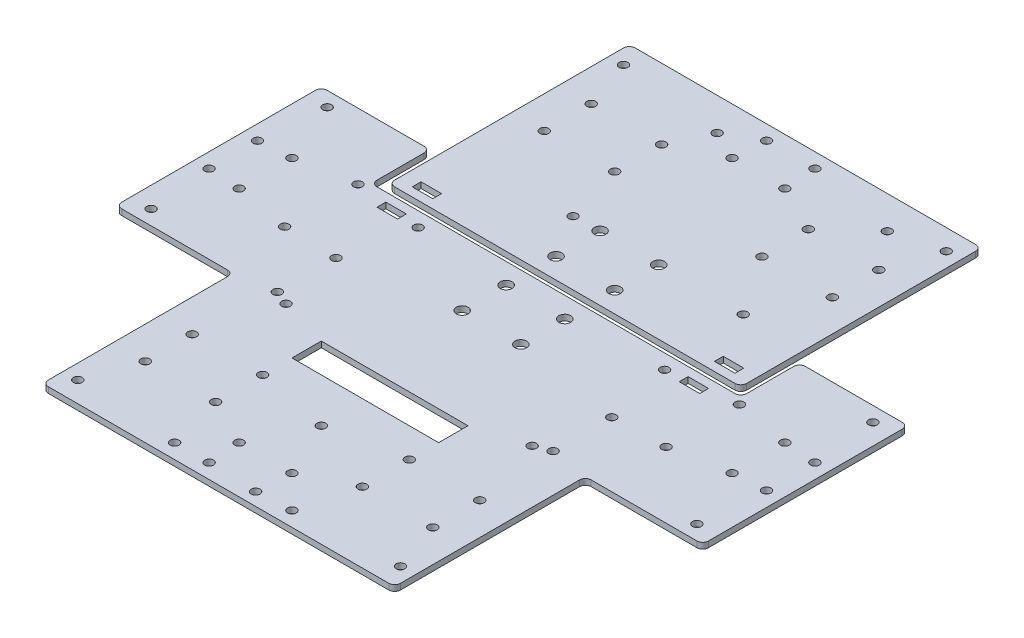
from build123d import *

# Parameters (mm, degrees)
SKETCH_1_W             = 200
SKETCH_1_H             = 200
EXTRUDE_341_DEPTH      = 2
SKETCH_2_W             = 40
SKETCH_2_H             = 65
CUT_EXTRUDE_671_DEPTH  = 2
SKETCH_3_R             = 1.5
CUT_EXTRUDE_1454_DEPTH = 2
SKETCH_4_R             = 1.5
CUT_EXTRUDE_2155_DEPTH = 2
SKETCH_5_R             = 1.5
CUT_EXTRUDE_3116_DEPTH = 10
SKETCH_7_R             = 2
CUT_EXTRUDE_3951_DEPTH = 10
CUT_EXTRUDE_4268_DEPTH = 10
FILLET_4341_R          = 2
FILLET_4941_R          = 2
SKETCH_11_R            = 1.5
CUT_EXTRUDE_1_DEPTH    = 10
SKETCH_13_R            = 1.5
CUT_EXTRUDE_3_DEPTH    = 10
SKETCH_14_R            = 1.5
CUT_EXTRUDE_4_DEPTH    = 10
SKETCH_15_R            = 1.5
CUT_EXTRUDE_5_DEPTH    = 10
SKETCH_16_R            = 1.5
CUT_EXTRUDE_6_DEPTH    = 10
SKETCH_17_W            = 50
SKETCH_17_H            = 10
CUT_EXTRUDE_7_DEPTH    = 10
SKETCH_18_W            = 7
SKETCH_18_H            = 3
CUT_EXTRUDE_8_DEPTH    = 10
SKETCH_19_R            = 1.5
CUT_EXTRUDE_9_DEPTH    = 10


with BuildPart() as part:
    # 草图1 → Extrude 341 (new body)
    with BuildSketch(Plane(origin=(0, 0, 0), x_dir=(1, 0, 0), z_dir=(0, 1, 0))):
        with Locations((2.122728297, 5.919482435)):
            Rectangle(SKETCH_1_W, SKETCH_1_H)
    extrude(amount=EXTRUDE_341_DEPTH)

    # 草图2 → Cut-Extrude 671 (cut)
    with BuildSketch(Plane(origin=(0, 2, 0), x_dir=(1, 0, 0), z_dir=(0, 1, 0))):
        with Locations((-77.877271703, 73.419482435)):
            Rectangle(SKETCH_2_W, SKETCH_2_H)
        with Locations((82.122728297, 73.419482435)):
            Rectangle(SKETCH_2_W, SKETCH_2_H)
        with Locations((82.122728297, -61.580517565)):
            Rectangle(SKETCH_2_W, SKETCH_2_H)
        with Locations((-77.877271703, -61.580517565)):
            Rectangle(SKETCH_2_W, SKETCH_2_H)
    extrude(amount=-CUT_EXTRUDE_671_DEPTH, mode=Mode.SUBTRACT)

    # 草图3 → Cut-Extrude 1454 (cut)
    with BuildSketch(Plane(origin=(0, 2, 0), x_dir=(1, 0, 0), z_dir=(0, 1, 0))):
        with Locations(Location((-46.877271703, 81.919482435, 0), (0, 0, 270))):
            Circle(SKETCH_3_R)
        with Locations(Location((-22.877271703, 81.919482435, 0), (0, 0, 270))):
            Circle(SKETCH_3_R)
        with Locations(Location((-46.877271703, 65.919482435, 0), (0, 0, 270))):
            Circle(SKETCH_3_R)
        with Locations(Location((-22.877271703, 65.919482435, 0), (0, 0, 270))):
            Circle(SKETCH_3_R)
        with Locations(Location((-46.877271703, -54.080517565, 0), (0, 0, 270))):
            Circle(SKETCH_3_R)
        with Locations(Location((-22.877271703, -54.080517565, 0), (0, 0, 270))):
            Circle(SKETCH_3_R)
        with Locations(Location((-46.877271703, -70.080517565, 0), (0, 0, 270))):
            Circle(SKETCH_3_R)
        with Locations(Location((-22.877271703, -70.080517565, 0), (0, 0, 270))):
            Circle(SKETCH_3_R)
        with Locations(Location((27.122728297, -54.080517565, 0), (0, 0, 270))):
            Circle(SKETCH_3_R)
        with Locations(Location((51.122728297, -54.080517565, 0), (0, 0, 270))):
            Circle(SKETCH_3_R)
        with Locations(Location((27.122728297, -70.080517565, 0), (0, 0, 270))):
            Circle(SKETCH_3_R)
        with Locations(Location((51.122728297, -70.080517565, 0), (0, 0, 270))):
            Circle(SKETCH_3_R)
        with Locations(Location((27.122728297, 81.919482435, 0), (0, 0, 270))):
            Circle(SKETCH_3_R)
        with Locations(Location((51.122728297, 81.919482435, 0), (0, 0, 270))):
            Circle(SKETCH_3_R)
        with Locations(Location((27.310966497, 65.920589774, 0), (0, 0, 270))):
            Circle(SKETCH_3_R)
        with Locations(Location((51.310966497, 65.920589774, 0), (0, 0, 270))):
            Circle(SKETCH_3_R)
    extrude(amount=-CUT_EXTRUDE_1454_DEPTH, mode=Mode.SUBTRACT)

    # 草图4 → Cut-Extrude 2155 (cut)
    with BuildSketch(Plane(origin=(0, 2, 0), x_dir=(1, 0, 0), z_dir=(0, 1, 0))):
        with Locations(Location((-6.877271703, 89.919482435, 0), (0, 0, 270))):
            Circle(SKETCH_4_R)
        with Locations(Location((11.122728297, 89.919482435, 0), (0, 0, 270))):
            Circle(SKETCH_4_R)
        with Locations(Location((-6.877271703, -78.080517565, 0), (0, 0, 270))):
            Circle(SKETCH_4_R)
        with Locations(Location((11.122728297, -78.080517565, 0), (0, 0, 270))):
            Circle(SKETCH_4_R)
        with Locations(Location((-81.877271703, 14.919482435, 0), (0, 0, 270))):
            Circle(SKETCH_4_R)
        with Locations(Location((-81.877271703, -3.080517565, 0), (0, 0, 270))):
            Circle(SKETCH_4_R)
        with Locations(Location((86.122728297, 14.919482435, 0), (0, 0, 270))):
            Circle(SKETCH_4_R)
        with Locations(Location((86.122728297, -3.080517565, 0), (0, 0, 270))):
            Circle(SKETCH_4_R)
    extrude(amount=-CUT_EXTRUDE_2155_DEPTH, mode=Mode.SUBTRACT)

    # 草图5 → Cut-Extrude 3116 (cut)
    with BuildSketch(Plane(origin=(0, 2, 0), x_dir=(1, 0, 0), z_dir=(0, 1, 0))):
        with Locations(Location((-52.877271703, -87.080517565, 0), (0, 0, 270))):
            Circle(SKETCH_5_R)
        with Locations(Location((57.122728297, -87.080517565, 0), (0, 0, 270))):
            Circle(SKETCH_5_R)
        with Locations(Location((57.122728297, 98.919482435, 0), (0, 0, 270))):
            Circle(SKETCH_5_R)
        with Locations(Location((-52.877271703, 98.919482435, 0), (0, 0, 270))):
            Circle(SKETCH_5_R)
        with Locations(Location((-90.877271703, 35.919482435, 0), (0, 0, 270))):
            Circle(SKETCH_5_R)
        with Locations(Location((-90.877271703, -24.080517565, 0), (0, 0, 270))):
            Circle(SKETCH_5_R)
        with Locations(Location((95.122728297, 35.919482435, 0), (0, 0, 270))):
            Circle(SKETCH_5_R)
        with Locations(Location((95.122728297, -24.080517565, 0), (0, 0, 270))):
            Circle(SKETCH_5_R)
    extrude(amount=-CUT_EXTRUDE_3116_DEPTH, mode=Mode.SUBTRACT)

    # 草图7 → Cut-Extrude 3951 (cut)
    with BuildSketch(Plane(origin=(0, 2, 0), x_dir=(1, 0, 0), z_dir=(0, 1, 0))):
        with Locations(Location((-7.877271703, 45.919482435, 0), (0, 0, 270))):
            Circle(SKETCH_7_R)
        with Locations(Location((-7.877271703, 30.919482435, 0), (0, 0, 270))):
            Circle(SKETCH_7_R)
        with Locations(Location((-7.877271703, 13.919482435, 0), (0, 0, 270))):
            Circle(SKETCH_7_R)
        with Locations(Location((-7.877271703, -1.080517565, 0), (0, 0, 270))):
            Circle(SKETCH_7_R)
        with Locations(Location((12.122728297, 45.919482435, 0), (0, 0, 270))):
            Circle(SKETCH_7_R)
        with Locations(Location((12.122728297, 30.919482435, 0), (0, 0, 270))):
            Circle(SKETCH_7_R)
        with Locations(Location((12.122728297, 13.919482435, 0), (0, 0, 270))):
            Circle(SKETCH_7_R)
        with Locations(Location((12.122728297, -1.080517565, 0), (0, 0, 270))):
            Circle(SKETCH_7_R)
    extrude(amount=-CUT_EXTRUDE_3951_DEPTH, mode=Mode.SUBTRACT)

    # 草图8 → Cut-Extrude 4268 (cut)
    with BuildSketch(Plane(origin=(0, 2, 0), x_dir=(1, 0, 0), z_dir=(0, 1, 0))):
        Polygon((-57.877271703, 40.919482435), (-57.877271703, 23.919482435), (62.122728297, 23.919482435), (62.122728297, 40.919482435), (65.122728297, 40.919482435), (65.122728297, 20.919482435), (-60.877271703, 20.919482435), (-60.877271703, 40.919482435), align=None)
    extrude(amount=-CUT_EXTRUDE_4268_DEPTH, mode=Mode.SUBTRACT)


with BuildPart() as cut_extrude_4268_piece_1:
    # of the separate pieces the step leaves, piece 1, a body of its own (cut_extrude_4268_pieces)
    add(part.part.solids().sort_by_distance((-60.877271703, 0, -40.919482435))[0])

    # Fillet 4341
    fillet_4341_edges = [cut_extrude_4268_piece_1.edges().sort_by_distance(p)[0] for p in [
        (-60.877271703, 1, -40.919482435),
        (65.122728297, 1, -20.919482435),
        (-60.877271703, 1, -20.919482435),
        (65.122728297, 1, -40.919482435),
        (-97.877271703, 1, 29.080517565),
        (-57.877271703, 1, 29.080517565),
        (-57.877271703, 1, 94.080517565),
        (102.122728297, 1, 29.080517565),
        (62.122728297, 1, 94.080517565),
        (62.122728297, 1, 29.080517565),
        (102.122728297, 1, -40.919482435),
        (-97.877271703, 1, -40.919482435),
    ]]
    fillet(fillet_4341_edges, radius=FILLET_4341_R)

    # 草图11 → 切除-拉伸1 (cut)
    with BuildSketch(Plane(origin=(0, 2, 0), x_dir=(1, 0, 0), z_dir=(0, 1, 0))):
        with Locations(Location((-17.877271703, -89.080517565, 0), (0, 0, 270))):
            Circle(SKETCH_11_R)
        with Locations(Location((22.122728297, -89.080517565, 0), (0, 0, 270))):
            Circle(SKETCH_11_R)
        with Locations(Location((2.122728297, -59.080517565, 0), (0, 0, 270))):
            Circle(SKETCH_11_R)
    extrude(amount=-CUT_EXTRUDE_1_DEPTH, mode=Mode.SUBTRACT)

    # 草图13 → 切除-拉伸3 (cut)
    with BuildSketch(Plane(origin=(0, 2, 0), x_dir=(1, 0, 0), z_dir=(0, 1, 0))):
        with Locations(Location((-39.877271703, 15.919482435, 0), (0, 0, 270))):
            Circle(SKETCH_13_R)
        with Locations(Location((44.122728297, 15.919482435, 0), (0, 0, 270))):
            Circle(SKETCH_13_R)
        with Locations(Location((-39.877271703, -29.080517565, 0), (0, 0, 270))):
            Circle(SKETCH_13_R)
        with Locations(Location((43.982792611, -29.080517565, 0), (0, 0, 270))):
            Circle(SKETCH_13_R)
    extrude(amount=-CUT_EXTRUDE_3_DEPTH, mode=Mode.SUBTRACT)


with BuildPart() as cut_extrude_4268_piece_2:
    # of the separate pieces the step leaves, piece 2, a body of its own (cut_extrude_4268_pieces)
    add(part.part.solids().sort_by_distance((-57.877271703, 0, -105.919482435))[0])

    # Fillet 4941
    fillet_4941_edges = [cut_extrude_4268_piece_2.edges().sort_by_distance(p)[0] for p in [
        (-57.877271703, 1, -105.919482435),
        (62.122728297, 1, -105.919482435),
        (-57.877271703, 1, -23.919482435),
        (62.122728297, 1, -23.919482435),
    ]]
    fillet(fillet_4941_edges, radius=FILLET_4941_R)


with BuildPart() as cut_extrude_4_tool:
    # 草图14 → 切除-拉伸4 (new body)
    with BuildSketch(Plane(origin=(0, 2, 0), x_dir=(1, 0, 0), z_dir=(0, 1, 0))):
        with Locations(Location((-6.127271703, 100.919482435, 0), (0, 0, 270))):
            Circle(SKETCH_14_R)
        with Locations(Location((10.372728297, 100.919482435, 0), (0, 0, 270))):
            Circle(SKETCH_14_R)
        with Locations(Location((-6.114539492, -89.080517565, 0), (0, 0, 270))):
            Circle(SKETCH_14_R)
        with Locations(Location((10.372728297, -89.728592295, 0), (0, 0, 270))):
            Circle(SKETCH_14_R)
        with Locations(Location((-92.877271703, 14.169482435, 0), (0, 0, 270))):
            Circle(SKETCH_14_R)
        with Locations(Location((-92.877271703, -2.330517565, 0), (0, 0, 270))):
            Circle(SKETCH_14_R)
        with Locations(Location((97.122728297, 14.169482435, 0), (0, 0, 270))):
            Circle(SKETCH_14_R)
        with Locations(Location((97.122728297, -2.330517565, 0), (0, 0, 270))):
            Circle(SKETCH_14_R)
    extrude(amount=-CUT_EXTRUDE_4_DEPTH)


with BuildPart() as cut_extrude_4268_piece_1_1:
    add(cut_extrude_4268_piece_1.part)

    # 切除-拉伸4: cut by cut_extrude_4_tool
    add(cut_extrude_4_tool.part, mode=Mode.SUBTRACT)

    # 草图15 → 切除-拉伸5 (cut)
    with BuildSketch(Plane(origin=(0, 2, 0), x_dir=(1, 0, 0), z_dir=(0, 1, 0))):
        with Locations(Location((-44.877271703, -7.080517565, 0), (0, 0, 270))):
            Circle(SKETCH_15_R)
        with Locations(Location((-44.877271703, -27.080517565, 0), (0, 0, 270))):
            Circle(SKETCH_15_R)
        with Locations(Location((49.122728297, -7.080517565, 0), (0, 0, 270))):
            Circle(SKETCH_15_R)
        with Locations(Location((49.122728297, -27.080517565, 0), (0, 0, 270))):
            Circle(SKETCH_15_R)
    extrude(amount=-CUT_EXTRUDE_5_DEPTH, mode=Mode.SUBTRACT)

    # 草图17 → 切除-拉伸7 (cut)
    with BuildSketch(Plane(origin=(0, 2, 0), x_dir=(1, 0, 0), z_dir=(0, 1, 0))):
        with Locations((2.122728297, -39.080517565)):
            Rectangle(SKETCH_17_W, SKETCH_17_H)
    extrude(amount=-CUT_EXTRUDE_7_DEPTH, mode=Mode.SUBTRACT)


with BuildPart() as cut_extrude_4268_piece_2_1:
    add(cut_extrude_4268_piece_2.part)

    # 切除-拉伸4: cut by cut_extrude_4_tool
    add(cut_extrude_4_tool.part, mode=Mode.SUBTRACT)

    # 草图16 → 切除-拉伸6 (cut)
    with BuildSketch(Plane(origin=(0, 2, 0), x_dir=(1, 0, 0), z_dir=(0, 1, 0))):
        with Locations(Location((-16.827271703, 94.765125879, 0), (0, 0, 270))):
            Circle(SKETCH_16_R)
        with Locations(Location((41.172728297, 94.765125879, 0), (0, 0, 270))):
            Circle(SKETCH_16_R)
        with Locations(Location((41.172728297, 45.665125879, 0), (0, 0, 270))):
            Circle(SKETCH_16_R)
        with Locations(Location((-16.827271703, 45.665125879, 0), (0, 0, 270))):
            Circle(SKETCH_16_R)
    extrude(amount=-CUT_EXTRUDE_6_DEPTH, mode=Mode.SUBTRACT)


with BuildPart() as cut_extrude_8_tool:
    # 草图18 → 切除-拉伸8 (new body)
    with BuildSketch(Plane.XZ):
        with Locations((53.622728297, -28.419482435)):
            Rectangle(SKETCH_18_W, SKETCH_18_H)
        with Locations((53.622728297, -16.419482435)):
            Rectangle(SKETCH_18_W, SKETCH_18_H)
        with Locations((-49.377271703, -28.419482435)):
            Rectangle(SKETCH_18_W, SKETCH_18_H)
        with Locations((-49.377271703, -16.419482435)):
            Rectangle(SKETCH_18_W, SKETCH_18_H)
    extrude(amount=-CUT_EXTRUDE_8_DEPTH)


with BuildPart() as cut_extrude_4268_piece_1_2:
    add(cut_extrude_4268_piece_1_1.part)

    # 切除-拉伸8: cut by cut_extrude_8_tool
    add(cut_extrude_8_tool.part, mode=Mode.SUBTRACT)

    # 草图19 → 切除-拉伸9 (cut)
    with BuildSketch(Plane.XZ):
        with Locations(Location((67.122728297, -18.419482435, 0), (0, 0, 270))):
            Circle(SKETCH_19_R)
        with Locations(Location((67.122728297, 6.580517565, 0), (0, 0, 270))):
            Circle(SKETCH_19_R)
        with Locations(Location((-62.877271703, -18.419482435, 0), (0, 0, 270))):
            Circle(SKETCH_19_R)
        with Locations(Location((-62.877271703, 6.580517565, 0), (0, 0, 270))):
            Circle(SKETCH_19_R)
    extrude(amount=-CUT_EXTRUDE_9_DEPTH, mode=Mode.SUBTRACT)


with BuildPart() as cut_extrude_4268_piece_2_2:
    add(cut_extrude_4268_piece_2_1.part)

    # 切除-拉伸8: cut by cut_extrude_8_tool
    add(cut_extrude_8_tool.part, mode=Mode.SUBTRACT)


solid = Compound([cut_extrude_4268_piece_1_2.part, cut_extrude_4268_piece_2_2.part])
